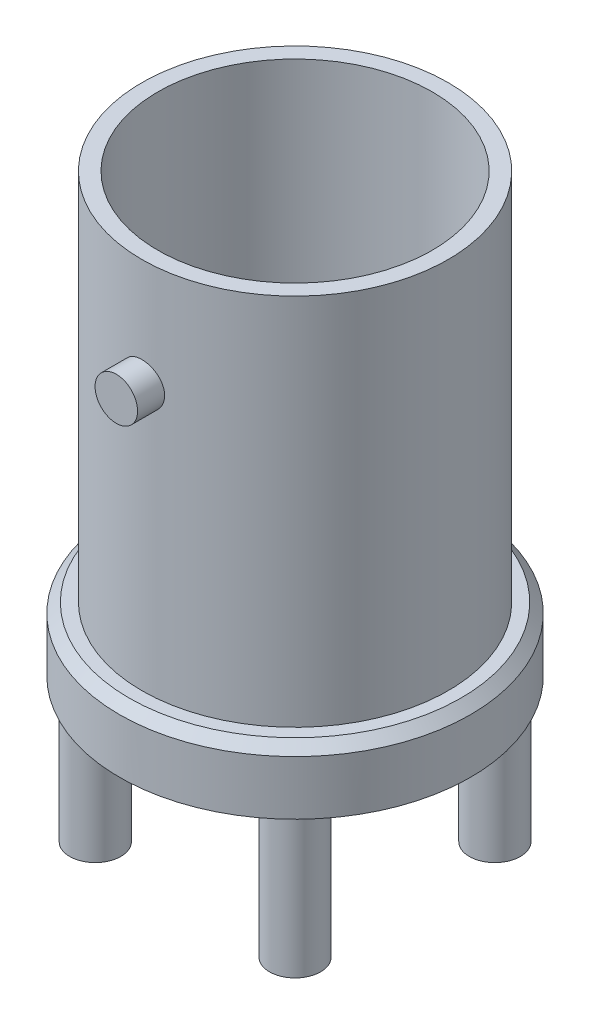
from build123d import *

# Parameters (mm, degrees)
BOSS_EXTRUDE1_START = -0.046461
SKETCH4_R           = 0.666231497
BOSS_EXTRUDE1_DEPTH = 0.846461
CHAMFER1_SIZE       = 0.3
FILLET1_R           = 0.2
CHAMFER2_SIZE       = 0.4
SKETCH5_R           = 0.55
BOSS_EXTRUDE2_DEPTH = 4.9
SKETCH5_3_R         = 0.8
BOSS_EXTRUDE3_DEPTH = 4.5


with BuildPart() as part:
    # Sketch1 → Revolve1 (revolve)
    with BuildSketch(Plane(origin=(0, 0, 0), x_dir=(0, 0, -1), z_dir=(1, 0, 0))):
        Polygon((0, 0), (0, 2), (0.286334312, 2), (0.286334312, 9.384488656), (1.723916807, 9.384488656), (1.723916807, 2), (4.3, 2), (4.3, 13.7), (4.8, 13.7), (4.8, 2), (5.5, 2), (5.5, 0), align=None)
    revolve(axis=Axis((0, 0, 0), (0, 1, 0)))

    # Sketch4 → Boss-Extrude1 (add)
    with BuildSketch(Plane.XY.offset(4.8).offset(BOSS_EXTRUDE1_START)):
        with Locations((0, 10.320424239)):
            Circle(SKETCH4_R)
    boss_extrude1 = extrude(amount=BOSS_EXTRUDE1_DEPTH)

    # Mirror1: Boss-Extrude1 across plane
    add(boss_extrude1.mirror(Plane(origin=(0, 0, 0), x_dir=(1, 0, 0), z_dir=(0, 0, -1))))

    # Chamfer1
    chamfer1_edges = [part.edges().sort_by_distance(p)[0] for p in [
        (0, 2, 5.5),
    ]]
    chamfer(chamfer1_edges, length=CHAMFER1_SIZE)

    # Fillet1
    fillet1_edges = [part.edges().sort_by_distance(p)[0] for p in [
        (0, 9.384488656, 0.286334312),
    ]]
    fillet(fillet1_edges, radius=FILLET1_R)

    # Chamfer2
    chamfer2_edges = [part.edges().sort_by_distance(p)[0] for p in [
        (0, 9.384488656, 1.723916807),
    ]]
    chamfer(chamfer2_edges, length=CHAMFER2_SIZE)

    # Sketch5 → Boss-Extrude2 (add)
    with BuildSketch(Plane.XZ):
        with Locations(Location((0, 0, 0), (0, 0, 270))):
            Circle(SKETCH5_R)
    extrude(amount=BOSS_EXTRUDE2_DEPTH)

    # Sketch5<3> → Boss-Extrude3 (add)
    with BuildSketch(Plane.XZ):
        with Locations(Location((-3.13, 3.13, 0), (0, 0, 270))):
            Circle(SKETCH5_3_R)
        with Locations(Location((3.13, 3.13, 0), (0, 0, 270))):
            Circle(SKETCH5_3_R)
        with Locations(Location((-3.13, -3.13, 0), (0, 0, 270))):
            Circle(SKETCH5_3_R)
        with Locations(Location((3.13, -3.13, 0), (0, 0, 270))):
            Circle(SKETCH5_3_R)
    extrude(amount=BOSS_EXTRUDE3_DEPTH)


solid = part.part
